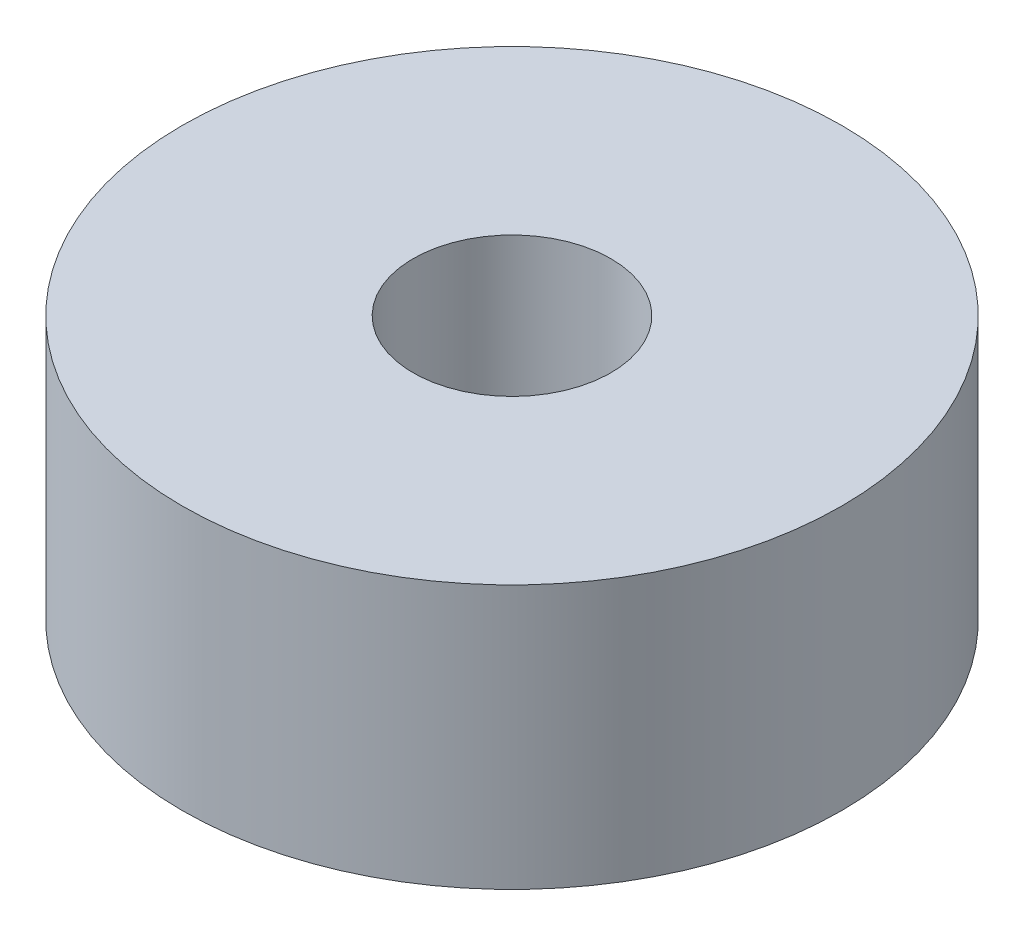
from build123d import *

# Parameters (mm, degrees)
SKETCH3_R               = 50
BOSS_EXTRUDE3_DEPTH     = 40
CUT_EXTRUDE4_DEPTH      = 82.240384046
CUT_EXTRUDE4_DEPTH_BACK = 30
SKETCH5_R               = 15


with BuildPart() as part:
    # Sketch3 → Boss-Extrude3 (new body)
    with BuildSketch(Plane(origin=(0, 0, 0), x_dir=(1, 0, 0), z_dir=(0, 1, 0))):
        with Locations(Location((0, 0, 0), (0, 0, 270))):
            Circle(SKETCH3_R)
    extrude(amount=BOSS_EXTRUDE3_DEPTH)

    # Sketch5 → Cut-Extrude4 (cut, two sides: drawn at the far end of the back side and taken through both)
    with BuildSketch(Plane(origin=(0, 40, 0), x_dir=(1, 0, 0), z_dir=(0, 1, 0)).offset(-CUT_EXTRUDE4_DEPTH_BACK)):
        with Locations(Location((0, 0, 0), (0, 0, 90))):
            Circle(SKETCH5_R)
    extrude(amount=CUT_EXTRUDE4_DEPTH + CUT_EXTRUDE4_DEPTH_BACK, mode=Mode.SUBTRACT)


solid = part.part
